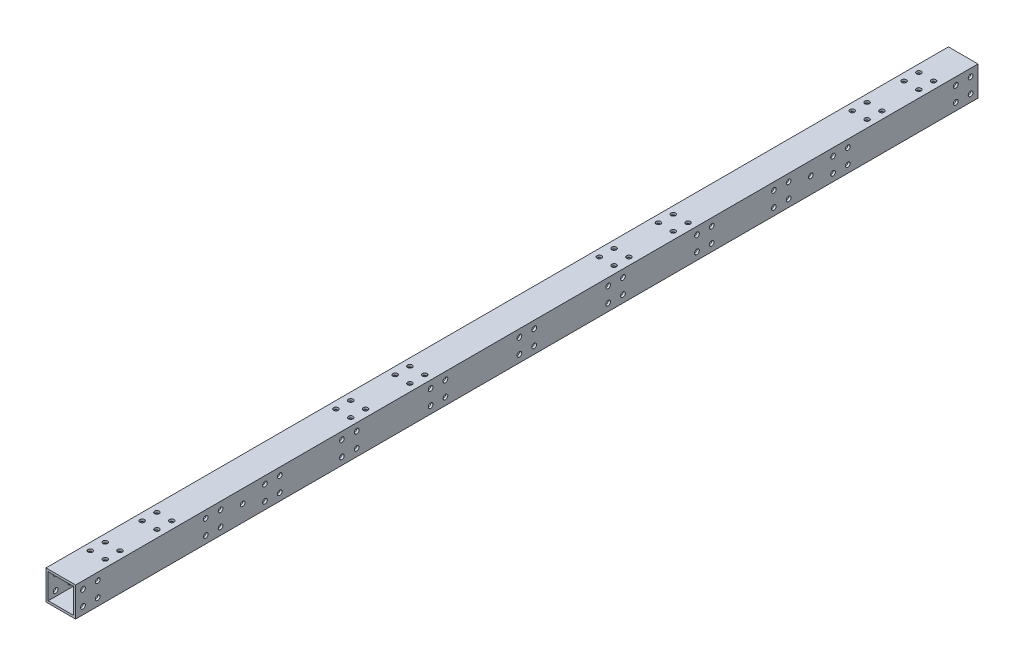
from build123d import *

# Parameters (mm, degrees)
SKETCH_1_W          = 20
SKETCH_1_H          = 20
SKETCH_1_W_2        = 17
SKETCH_1_H_2        = 17
EXTRUDE_1_DEPTH     = 610
SKETCH_2_R          = 1.575
CUT_EXTRUDE_1_DEPTH = 611.655385631
SKETCH_3_R          = 1.575
SKETCH_3_R_2        = 1.6
CUT_EXTRUDE_2_DEPTH = 611.655385631


with BuildPart() as part:
    # 草图1 → 拉伸-薄壁1 (new body)
    with BuildSketch(Plane.XY):
        with Locations((10, -10)):
            Rectangle(SKETCH_1_W, SKETCH_1_H)
        with Locations((10, -10)):
            Rectangle(SKETCH_1_W_2, SKETCH_1_H_2, mode=Mode.SUBTRACT)
    extrude(amount=EXTRUDE_1_DEPTH)

    # 草图2 → 切除-拉伸1 (cut, through all)
    with BuildSketch(Plane(origin=(0, 0, 0), x_dir=(1, 0, 0), z_dir=(0, 1, 0))):
        with Locations(Location((5, -231, 0), (0, 0, 270))):
            Circle(SKETCH_2_R)
        with Locations(Location((15, -231, 0), (0, 0, 90))):
            Circle(SKETCH_2_R)
        with Locations(Location((15, -241, 0), (0, 0, 270))):
            Circle(SKETCH_2_R)
        with Locations(Location((5, -241, 0), (0, 0, 90))):
            Circle(SKETCH_2_R)
        with Locations(Location((5, -369, 0), (0, 0, 270))):
            Circle(SKETCH_2_R)
        with Locations(Location((15, -369, 0), (0, 0, 90))):
            Circle(SKETCH_2_R)
        with Locations(Location((15, -379, 0), (0, 0, 270))):
            Circle(SKETCH_2_R)
        with Locations(Location((5, -379, 0), (0, 0, 90))):
            Circle(SKETCH_2_R)
        with Locations(Location((5, -25, 0), (0, 0, 270))):
            Circle(SKETCH_2_R)
        with Locations(Location((15, -25, 0), (0, 0, 90))):
            Circle(SKETCH_2_R)
        with Locations(Location((15, -35, 0), (0, 0, 270))):
            Circle(SKETCH_2_R)
        with Locations(Location((5, -35, 0), (0, 0, 90))):
            Circle(SKETCH_2_R)
        with Locations(Location((5, -575, 0), (0, 0, 270))):
            Circle(SKETCH_2_R)
        with Locations(Location((15, -575, 0), (0, 0, 90))):
            Circle(SKETCH_2_R)
        with Locations(Location((15, -585, 0), (0, 0, 270))):
            Circle(SKETCH_2_R)
        with Locations(Location((5, -585, 0), (0, 0, 90))):
            Circle(SKETCH_2_R)
        with Locations(Location((5, -60, 0), (0, 0, 270))):
            Circle(SKETCH_2_R)
        with Locations(Location((15, -60, 0), (0, 0, 90))):
            Circle(SKETCH_2_R)
        with Locations(Location((15, -70, 0), (0, 0, 270))):
            Circle(SKETCH_2_R)
        with Locations(Location((5, -70, 0), (0, 0, 90))):
            Circle(SKETCH_2_R)
        with Locations(Location((5, -540, 0), (0, 0, 270))):
            Circle(SKETCH_2_R)
        with Locations(Location((15, -540, 0), (0, 0, 90))):
            Circle(SKETCH_2_R)
        with Locations(Location((15, -550, 0), (0, 0, 270))):
            Circle(SKETCH_2_R)
        with Locations(Location((5, -550, 0), (0, 0, 90))):
            Circle(SKETCH_2_R)
        with Locations(Location((5, -191, 0), (0, 0, 270))):
            Circle(SKETCH_2_R)
        with Locations(Location((15, -191, 0), (0, 0, 90))):
            Circle(SKETCH_2_R)
        with Locations(Location((15, -201, 0), (0, 0, 270))):
            Circle(SKETCH_2_R)
        with Locations(Location((5, -201, 0), (0, 0, 90))):
            Circle(SKETCH_2_R)
        with Locations(Location((5, -409, 0), (0, 0, 270))):
            Circle(SKETCH_2_R)
        with Locations(Location((15, -409, 0), (0, 0, 90))):
            Circle(SKETCH_2_R)
        with Locations(Location((15, -419, 0), (0, 0, 270))):
            Circle(SKETCH_2_R)
        with Locations(Location((5, -419, 0), (0, 0, 90))):
            Circle(SKETCH_2_R)
    extrude(amount=-CUT_EXTRUDE_1_DEPTH, mode=Mode.SUBTRACT)

    # 草图3 → 切除-拉伸2 (cut, through all)
    with BuildSketch(Plane.ZY):
        with Locations(Location((113, -9, 0), (0, 0, 270))):
            Circle(SKETCH_3_R)
        with Locations((497, -9)):
            Circle(SKETCH_3_R)
        with Locations(Location((88, -5, 0), (0, 0, 270))):
            Circle(SKETCH_3_R)
        with Locations((88, -15)):
            Circle(SKETCH_3_R)
        with Locations(Location((98, -15, 0), (0, 0, 270))):
            Circle(SKETCH_3_R)
        with Locations((98, -5)):
            Circle(SKETCH_3_R)
        with Locations(Location((512, -5, 0), (0, 0, 270))):
            Circle(SKETCH_3_R)
        with Locations((512, -15)):
            Circle(SKETCH_3_R)
        with Locations(Location((522, -15, 0), (0, 0, 270))):
            Circle(SKETCH_3_R)
        with Locations((522, -5)):
            Circle(SKETCH_3_R)
        with Locations(Location((128, -5, 0), (0, 0, 270))):
            Circle(SKETCH_3_R)
        with Locations((128, -15)):
            Circle(SKETCH_3_R)
        with Locations(Location((138, -15, 0), (0, 0, 270))):
            Circle(SKETCH_3_R)
        with Locations((138, -5)):
            Circle(SKETCH_3_R)
        with Locations(Location((472, -5, 0), (0, 0, 270))):
            Circle(SKETCH_3_R)
        with Locations((472, -15)):
            Circle(SKETCH_3_R)
        with Locations(Location((482, -15, 0), (0, 0, 270))):
            Circle(SKETCH_3_R)
        with Locations((482, -5)):
            Circle(SKETCH_3_R)
        with Locations(Location((300, -5, 0), (0, 0, 270))):
            Circle(SKETCH_3_R_2)
        with Locations((300, -15)):
            Circle(SKETCH_3_R_2)
        with Locations(Location((310, -15, 0), (0, 0, 270))):
            Circle(SKETCH_3_R_2)
        with Locations((310, -5)):
            Circle(SKETCH_3_R_2)
        with Locations((250, -5)):
            Circle(SKETCH_3_R_2)
        with Locations(Location((240, -5, 0), (0, 0, 270))):
            Circle(SKETCH_3_R_2)
        with Locations((240, -15)):
            Circle(SKETCH_3_R_2)
        with Locations(Location((250, -15, 0), (0, 0, 270))):
            Circle(SKETCH_3_R_2)
        with Locations((190, -5)):
            Circle(SKETCH_3_R_2)
        with Locations(Location((180, -5, 0), (0, 0, 270))):
            Circle(SKETCH_3_R_2)
        with Locations((180, -15)):
            Circle(SKETCH_3_R_2)
        with Locations(Location((190, -15, 0), (0, 0, 270))):
            Circle(SKETCH_3_R_2)
        with Locations((420, -15)):
            Circle(SKETCH_3_R_2)
        with Locations(Location((430, -15, 0), (0, 0, 270))):
            Circle(SKETCH_3_R_2)
        with Locations((430, -5)):
            Circle(SKETCH_3_R_2)
        with Locations(Location((420, -5, 0), (0, 0, 270))):
            Circle(SKETCH_3_R_2)
        with Locations((360, -15)):
            Circle(SKETCH_3_R_2)
        with Locations(Location((370, -15, 0), (0, 0, 270))):
            Circle(SKETCH_3_R_2)
        with Locations((370, -5)):
            Circle(SKETCH_3_R_2)
        with Locations(Location((360, -5, 0), (0, 0, 270))):
            Circle(SKETCH_3_R_2)
        with Locations(Location((5, -5, 0), (0, 0, 270))):
            Circle(SKETCH_3_R_2)
        with Locations((5, -15)):
            Circle(SKETCH_3_R_2)
        with Locations(Location((15, -15, 0), (0, 0, 270))):
            Circle(SKETCH_3_R_2)
        with Locations((15, -5)):
            Circle(SKETCH_3_R_2)
        with Locations(Location((595, -5, 0), (0, 0, 270))):
            Circle(SKETCH_3_R_2)
        with Locations((595, -15)):
            Circle(SKETCH_3_R_2)
        with Locations(Location((605, -15, 0), (0, 0, 270))):
            Circle(SKETCH_3_R_2)
        with Locations((605, -5)):
            Circle(SKETCH_3_R_2)
    extrude(amount=-CUT_EXTRUDE_2_DEPTH, mode=Mode.SUBTRACT)


solid = part.part
